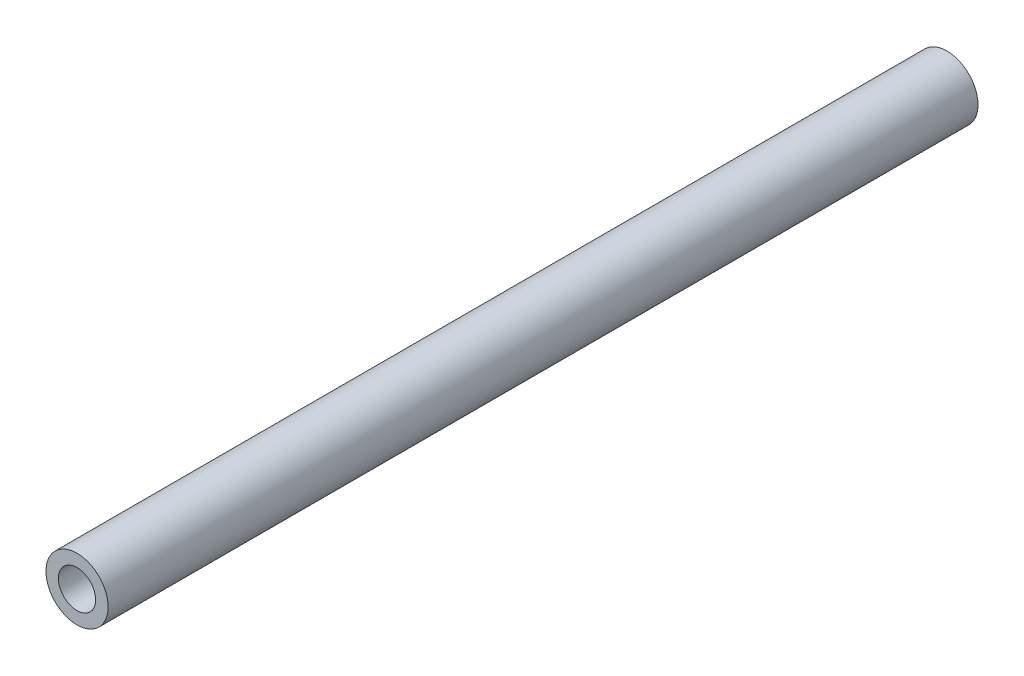
from build123d import *

# Parameters (mm, degrees)
SKETCH_1_R      = 2.5
SKETCH_1_R_2    = 1.5
EXTRUDE_1_DEPTH = 70


with BuildPart() as part:
    # 草图1 → 凸台-拉伸1 (new body)
    with BuildSketch(Plane.XY):
        Circle(SKETCH_1_R)
        Circle(SKETCH_1_R_2, mode=Mode.SUBTRACT)
    extrude(amount=EXTRUDE_1_DEPTH)


solid = part.part
